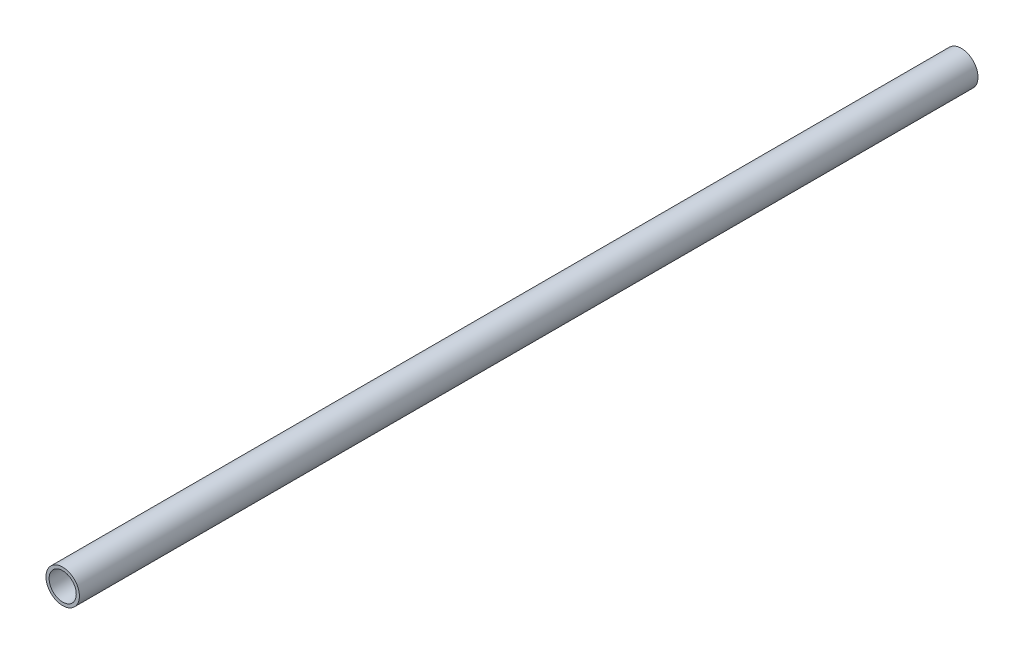
from build123d import *

# Parameters (mm, degrees)
CROQUIS1_R     = 16
EXTRUIR1_DEPTH = 430
VACIADO1_T     = -3


with BuildPart() as part:
    # Croquis1 → Extruir1 (new, symmetric)
    with BuildSketch(Plane.XY):
        Circle(CROQUIS1_R)
    extrude(amount=EXTRUIR1_DEPTH, both=True)

    # Vaciado1
    vaciado1_openings = [part.faces().sort_by_distance(p)[0] for p in [
        (0, 0, 430),
        (0, 0, -430),
    ]]
    offset(amount=VACIADO1_T, openings=vaciado1_openings, kind=Kind.INTERSECTION)


solid = part.part
